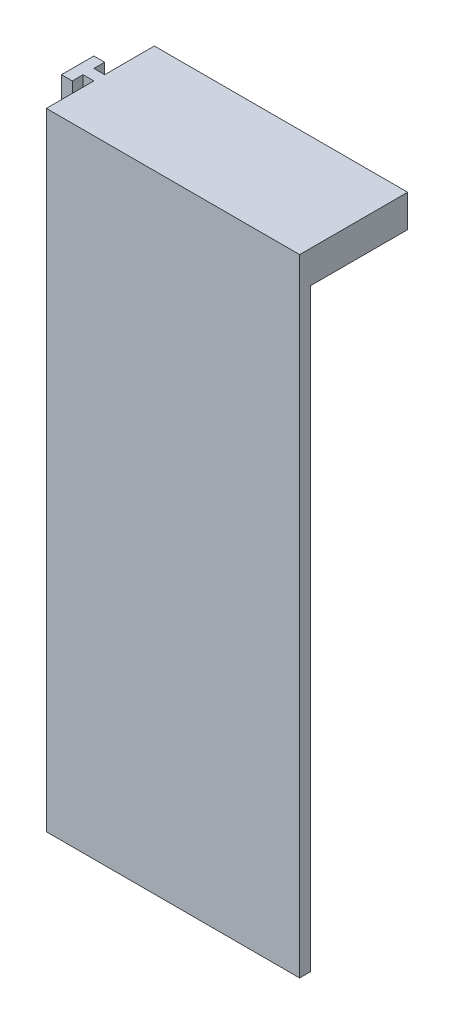
from build123d import *

# Parameters (mm, degrees)
SKETCH_1_W          = 23.45
SKETCH_1_H          = 10
EXTRUDE_1_DEPTH     = 58
EXTRUDE_2_DEPTH     = 58
SKETCH_5_W          = 23.35
SKETCH_5_H          = 55
CUT_EXTRUDE_2_DEPTH = 9.01


with BuildPart() as part:
    # 草圖1 → 填料-伸長1 (new body)
    with BuildSketch(Plane(origin=(0, 0, 0), x_dir=(1, 0, 0), z_dir=(0, 1, 0))):
        Rectangle(SKETCH_1_W, SKETCH_1_H)
    extrude(amount=EXTRUDE_1_DEPTH)

    # 草圖3 → 填料-伸長2 (add)
    with BuildSketch(Plane(origin=(0, 58, 0), x_dir=(1, 0, 0), z_dir=(0, 1, 0))):
        Polygon((-11.725, 0.4), (-12.725, 0.4), (-12.725, 1.4), (-13.725, 1.4), (-13.725, -1.60013631), (-12.725, -1.60013631), (-12.725, -0.6), (-11.725, -0.6), align=None)
    extrude(amount=-EXTRUDE_2_DEPTH)

    # 草圖5 → 除料-伸長2 (cut)
    with BuildSketch(Plane(origin=(0, 0, -5), x_dir=(-1, 0, 0), z_dir=(0, 0, -1))):
        with Locations((-0.05, 27.5)):
            Rectangle(SKETCH_5_W, SKETCH_5_H)
    extrude(amount=-CUT_EXTRUDE_2_DEPTH, mode=Mode.SUBTRACT)


solid = part.part
